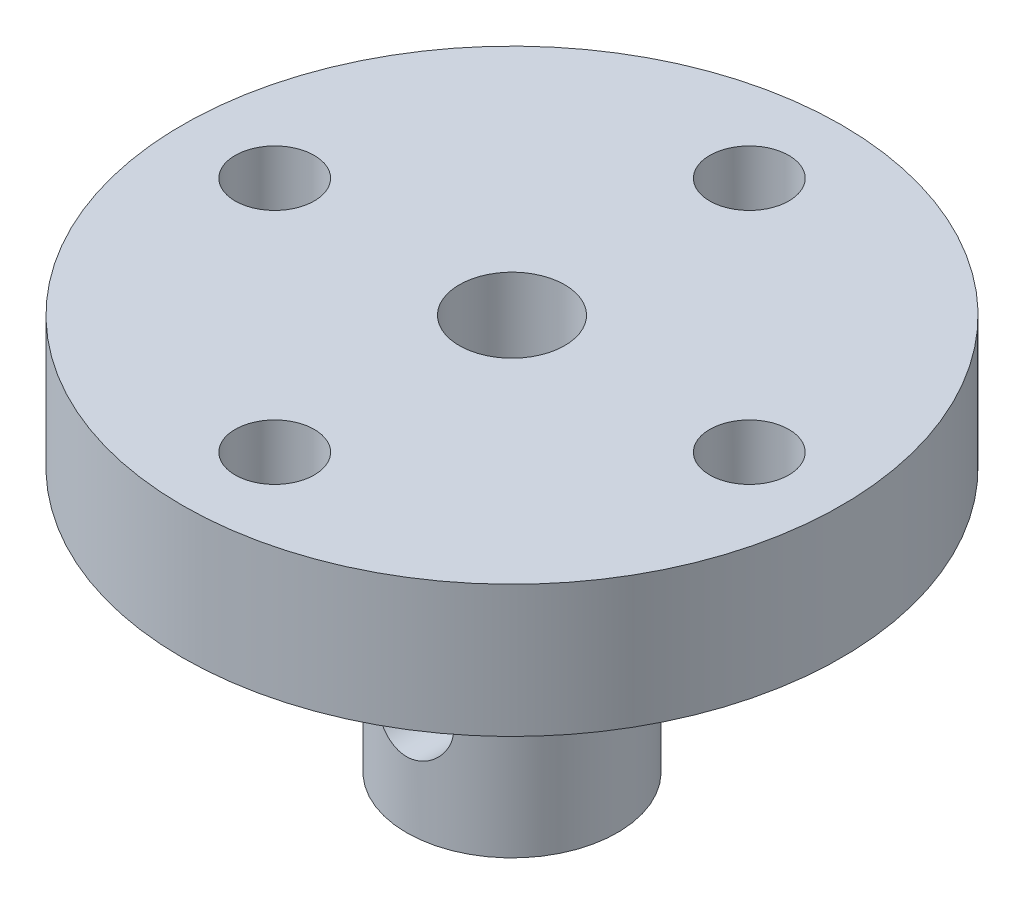
from build123d import *

# Parameters (mm, degrees)
SKETCH1_R                = 4
BOSS_EXTRUDE1_DEPTH      = 10
SKETCH3_R                = 12.5
BOSS_EXTRUDE2_DEPTH      = 5
F_3_0_3_DIAMETER_HOLE2_D = 3
SKETCH6_R                = 1.5
CUT_EXTRUDE2_DEPTH       = 10
SKETCH2_R                = 2
CUT_EXTRUDE1_DEPTH       = 24.184046239
CIRPATTERN1_COUNT        = 4


with BuildPart() as part:
    # Sketch1 → Boss-Extrude1 (new body)
    with BuildSketch(Plane(origin=(0, 0, 0), x_dir=(1, 0, 0), z_dir=(0, 1, 0))):
        with Locations(Location((0, 0, 0), (0, 0, 270))):
            Circle(SKETCH1_R)
    extrude(amount=BOSS_EXTRUDE1_DEPTH)

    # Sketch3 → Boss-Extrude2 (add)
    with BuildSketch(Plane(origin=(0, 10, 0), x_dir=(1, 0, 0), z_dir=(0, 1, 0))):
        with Locations(Location((0, 0, 0), (0, 0, 270))):
            Circle(SKETCH3_R)
    extrude(amount=BOSS_EXTRUDE2_DEPTH)

    # Ø3.0 (3) Diameter Hole2 (through all)
    with Locations(Plane(origin=(0, 4, -4), x_dir=(-1, 0, 0), z_dir=(0, 0, -1))):
        with Locations((0, 0)):
            Hole(F_3_0_3_DIAMETER_HOLE2_D / 2)

    # Sketch6 → Cut-Extrude2 (cut)
    with BuildSketch(Plane(origin=(0, 15, 0), x_dir=(1, 0, 0), z_dir=(0, 1, 0))):
        with Locations(Location((-9, 0, 0), (0, 0, 270))):
            Circle(SKETCH6_R)
    cut_extrude2 = extrude(amount=-CUT_EXTRUDE2_DEPTH, mode=Mode.SUBTRACT)

    # Sketch2 → Cut-Extrude1 (cut, through all)
    with BuildSketch(Plane.XZ):
        with Locations(Location((0, 0, 0), (0, 0, 270))):
            Circle(SKETCH2_R)
    extrude(amount=-CUT_EXTRUDE1_DEPTH, mode=Mode.SUBTRACT)

    # CirPattern1: Cut-Extrude2 ×4 about axis
    cirpattern1_axis = Axis((0, 0, 0), (0, 1, 0))
    for i in range(1, CIRPATTERN1_COUNT):
        add(cut_extrude2.rotate(cirpattern1_axis, i * 360 / CIRPATTERN1_COUNT), mode=Mode.SUBTRACT)


solid = part.part
